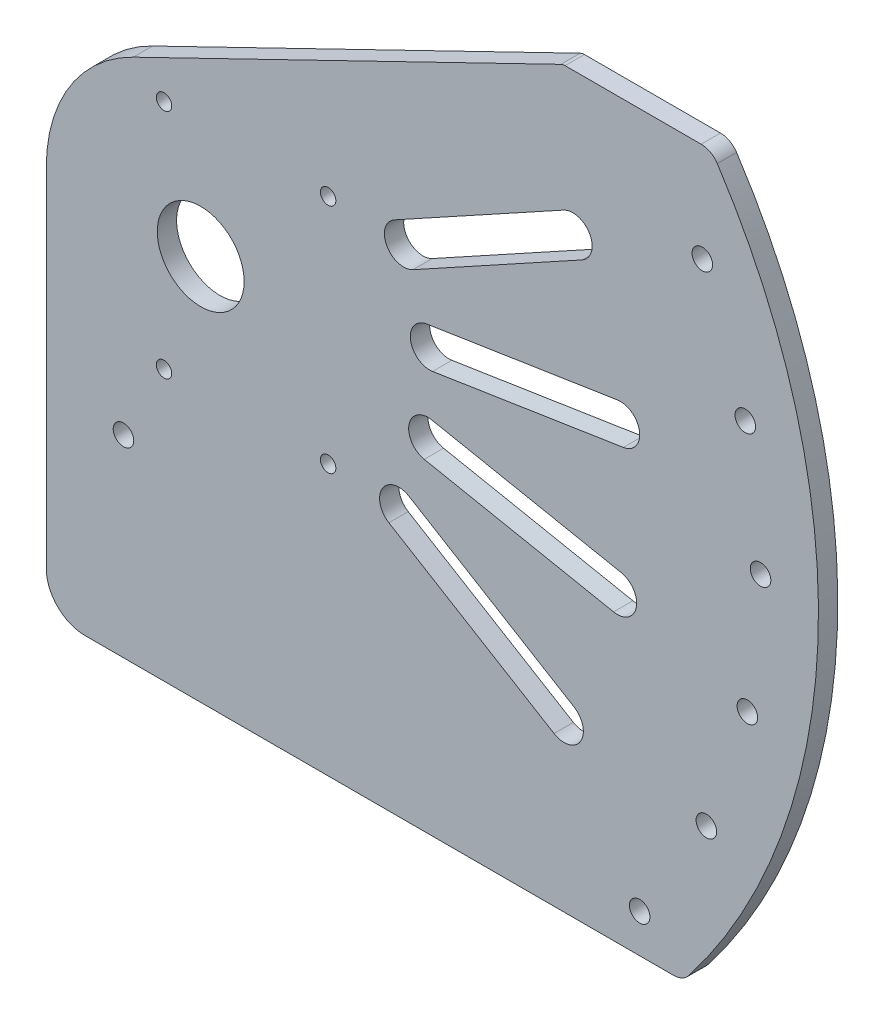
from build123d import *

# Parameters (mm, degrees)
SKETCH1_R           = 3.3782
SKETCH1_R_2         = 14.2875
BOSS_EXTRUDE1_DEPTH = 6.35
FILLET1_R           = 3.175
SKETCH2_R           = 2.54
CUT_EXTRUDE1_DEPTH  = 6.35


with BuildPart() as part:
    # Sketch1 → Boss-Extrude1 (new body)
    with BuildSketch(Plane.XY):
        with BuildLine():
            ThreePointArc((155.542598667, -127), (158.336226208, -126.352468339), (160.56010185, -124.541935484))
            ThreePointArc((160.56010185, -124.541935484), (203.040311847, -8.054301034), (169.920839989, 111.432258065))
            ThreePointArc((169.920839989, 111.432258065), (167.628276357, 113.537255082), (164.61081374, 114.3))
            Line((164.61081374, 114.3), (119.1365603, 114.3))
            Line((119.1365603, 114.3), (-22.183826694, 45.70030452))
            ThreePointArc((-22.183826694, 45.70030452), (-43.055652335, 26.960170659), (-50.8, 0))
            Line((-50.8, 0), (-50.8, -114.3))
            ThreePointArc((-50.8, -114.3), (-47.080256121, -123.280256121), (-38.1, -127))
            Line((-38.1, -127), (155.542598667, -127))
        make_face()
        with Locations((144.383975911, -114.3)):
            Circle(SKETCH1_R, mode=Mode.SUBTRACT)
        with Locations((166.325065928, -79.042592339)):
            Circle(SKETCH1_R, mode=Mode.SUBTRACT)
        with Locations((179.808375328, -39.76541584)):
            Circle(SKETCH1_R, mode=Mode.SUBTRACT)
        with Locations((184.148262492, 1.5342404)):
            Circle(SKETCH1_R, mode=Mode.SUBTRACT)
        with Locations((179.124039222, 42.756241887)):
            Circle(SKETCH1_R, mode=Mode.SUBTRACT)
        with Locations((164.991192987, 81.804402963)):
            Circle(SKETCH1_R, mode=Mode.SUBTRACT)
        with BuildLine():
            Line((63.70579448, 42.288701206), (119.344293443, 72.892743964))
            ThreePointArc((119.344293443, 72.892743964), (127.968547615, 70.389298344), (125.465101994, 61.765044172))
            Line((125.465101994, 61.765044172), (69.826603031, 31.161001414))
            ThreePointArc((69.826603031, 31.161001414), (61.202348859, 33.664447034), (63.70579448, 42.288701206))
        make_face(mode=Mode.SUBTRACT)
        with BuildLine():
            ThreePointArc((61.899520347, -44.891111378), (59.755440765, -36.170565366), (68.475986777, -34.026485785))
            Line((68.475986777, -34.026485785), (122.799114746, -66.908817936))
            ThreePointArc((122.799114746, -66.908817936), (124.943194328, -75.629363948), (116.222648316, -77.77344353))
            Line((116.222648316, -77.77344353), (61.899520347, -44.891111378))
        make_face(mode=Mode.SUBTRACT)
        with BuildLine():
            ThreePointArc((73.520186848, -21.01296328), (68.52280869, -13.551648949), (75.984123021, -8.554270791))
            Line((75.984123021, -8.554270791), (138.277585466, -20.873951654))
            ThreePointArc((138.277585466, -20.873951654), (143.274963624, -28.335265985), (135.813649293, -33.332644143))
            Line((135.813649293, -33.332644143), (73.520186848, -21.01296328))
        make_face(mode=Mode.SUBTRACT)
        with BuildLine():
            ThreePointArc((76.273233773, 5.399658308), (69.025314597, 10.701796332), (74.327452622, 17.949715507))
            Line((74.327452622, 17.949715507), (137.077738619, 27.678621264))
            ThreePointArc((137.077738619, 27.678621264), (144.325657795, 22.37648324), (139.02351977, 15.128564064))
            Line((139.02351977, 15.128564064), (76.273233773, 5.399658308))
        make_face(mode=Mode.SUBTRACT)
        Circle(SKETCH1_R_2, mode=Mode.SUBTRACT)
        with Locations((-25.4, -63.5)):
            Circle(SKETCH1_R, mode=Mode.SUBTRACT)
    extrude(amount=BOSS_EXTRUDE1_DEPTH)

    # Fillet1
    fillet1_edges = [part.edges().sort_by_distance(p)[0] for p in [
        (119.1365603, 114.3, 3.175),
    ]]
    fillet(fillet1_edges, radius=FILLET1_R)

    # Sketch2 → Cut-Extrude1 (cut)
    with BuildSketch(Plane.XY.offset(6.35)):
        with Locations((-12.072682951, 38.1)):
            Circle(SKETCH2_R)
        with Locations((-12.072682951, -38.1)):
            Circle(SKETCH2_R)
        with Locations((41.902317049, -38.1)):
            Circle(SKETCH2_R)
        with Locations((41.902317049, 38.1)):
            Circle(SKETCH2_R)
    extrude(amount=-CUT_EXTRUDE1_DEPTH, mode=Mode.SUBTRACT)


solid = part.part
